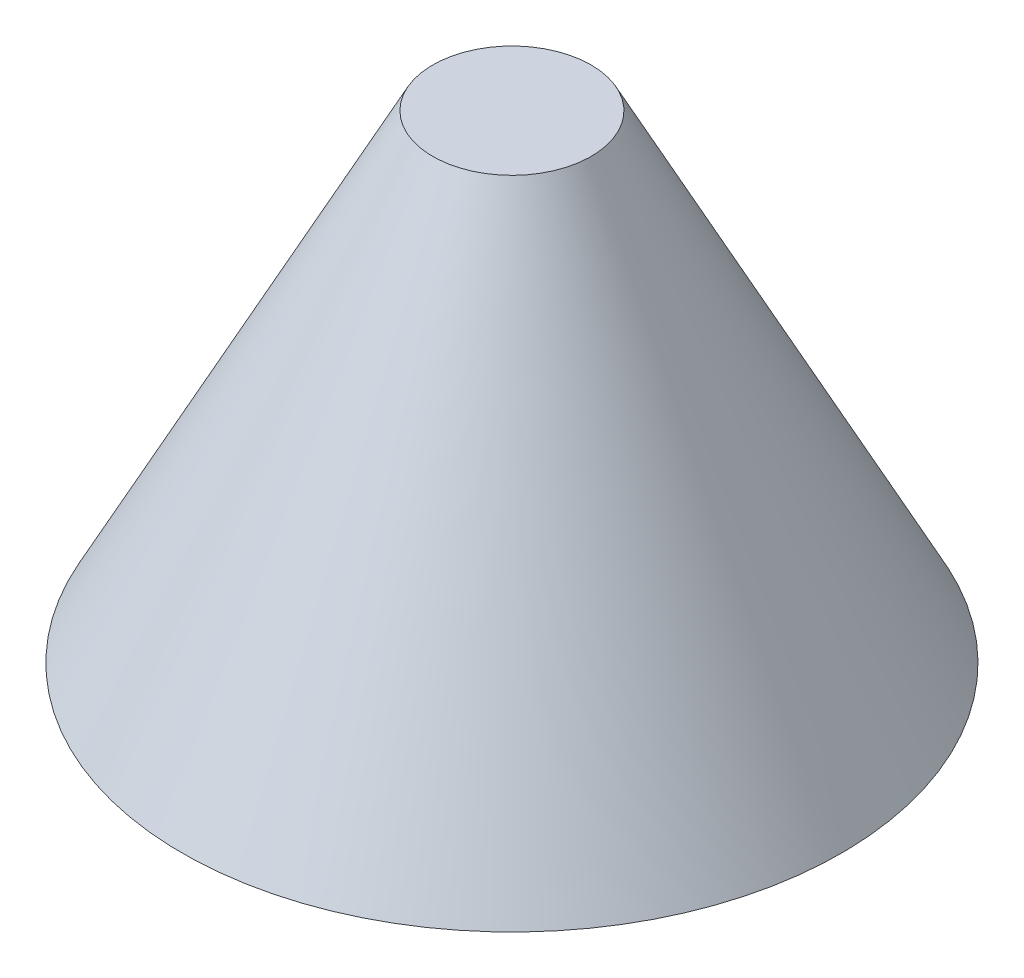
from build123d import *


with BuildPart() as part:
    # 草图1 → 旋转1 (revolve)
    with BuildSketch(Plane.XY, mode=Mode.PRIVATE) as revolve_1_sk:
        Polygon((0, 0), (0.2, 0), (0.048082683, 0.290239588), (0, 0.290239588), align=None)
    revolve(revolve_1_sk.sketch.rotate(Axis((0, 0, 0), (0, 1, 0)), 90), axis=Axis((0, 0, 0), (0, 1, 0)))


solid = part.part
